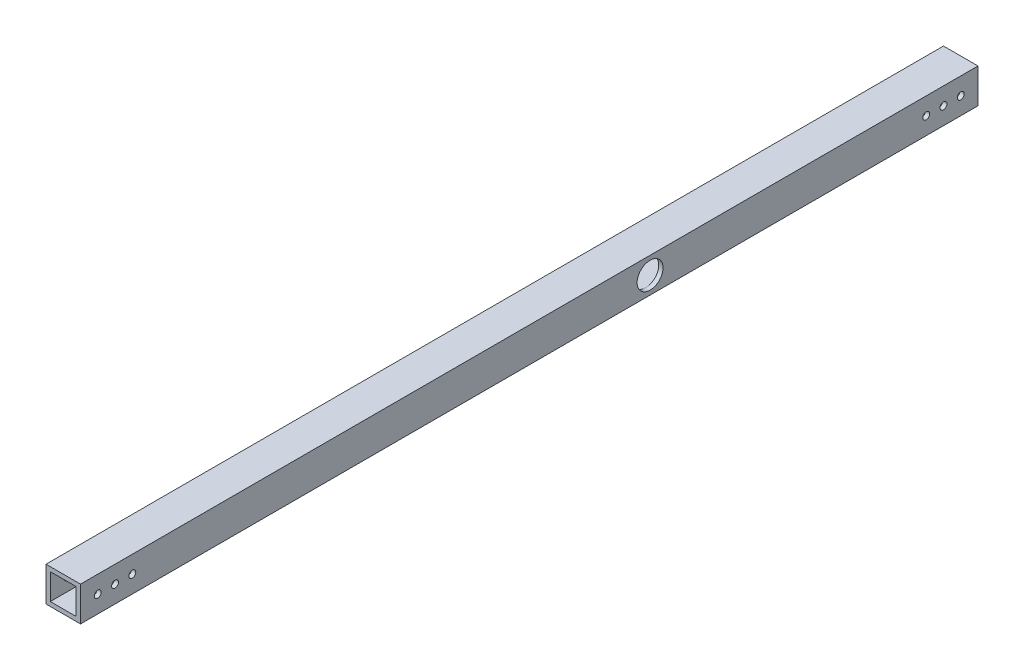
from build123d import *

# Parameters (mm, degrees)
SKETCH1_W              = 25.4
SKETCH1_H              = 25.4
SKETCH1_W_2            = 19.05
SKETCH1_H_2            = 19.05
EXTRUDE_THIN1_DEPTH    = 660.4
SKETCH4_R              = 9.525
CUT_EXTRUDE1_DEPTH     = 662.376201568
F_10_CLEARANCE_HOLE2_D = 5.1054
F_10_CLEARANCE_HOLE3_D = 5.1054


with BuildPart() as part:
    # Sketch1 → Extrude-Thin1 (new body)
    with BuildSketch(Plane.XY):
        with Locations((-12.7, 12.7)):
            Rectangle(SKETCH1_W, SKETCH1_H)
        with Locations((-12.7, 12.7)):
            Rectangle(SKETCH1_W_2, SKETCH1_H_2, mode=Mode.SUBTRACT)
    extrude(amount=EXTRUDE_THIN1_DEPTH)

    # Sketch4 → Cut-Extrude1 (cut, through all)
    with BuildSketch(Plane.ZY.offset(25.4)):
        with Locations((241.3, 12.7)):
            Circle(SKETCH4_R)
    extrude(amount=-CUT_EXTRUDE1_DEPTH, mode=Mode.SUBTRACT)

    # #10 Clearance Hole2 (through all)
    with Locations(Plane.ZY.offset(25.4)):
        with Locations((12.7, 12.7), (25.4, 12.7), (38.1, 12.7)):
            Hole(F_10_CLEARANCE_HOLE2_D / 2)

    # #10 Clearance Hole3 (through all)
    with Locations(Plane.ZY.offset(25.4)):
        with Locations((622.3, 12.7), (635, 12.7), (647.7, 12.7)):
            Hole(F_10_CLEARANCE_HOLE3_D / 2)


solid = part.part
